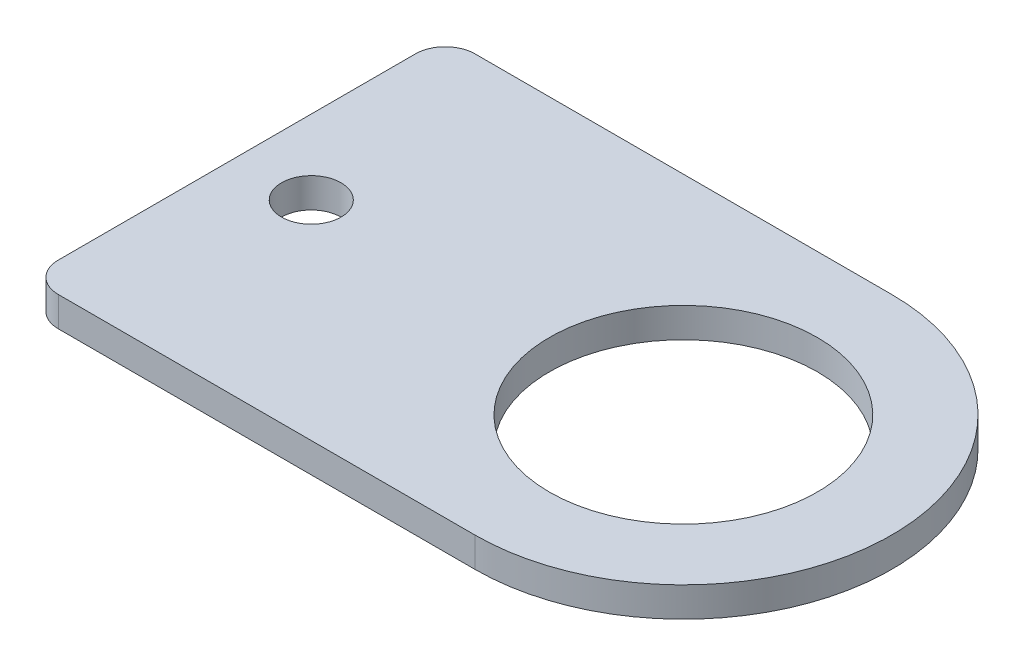
from build123d import *

# Parameters (mm, degrees)
SKETCH1_R           = 2
SKETCH1_R_2         = 9
BOSS_EXTRUDE1_DEPTH = 2
FILLET1_R           = 2


with BuildPart() as part:
    # Sketch1 → Boss-Extrude1 (new body)
    with BuildSketch(Plane(origin=(0, 0, 0), x_dir=(1, 0, 0), z_dir=(0, 1, 0))):
        with BuildLine():
            Line((-15, -14), (15, -14))
            ThreePointArc((15, -14), (29, 0), (15, 14))
            Line((15, 14), (-15, 14))
            Line((-15, 14), (-15, -14))
        make_face()
        with Locations(Location((-10, 0, 0), (0, 0, 270))):
            Circle(SKETCH1_R, mode=Mode.SUBTRACT)
        with Locations(Location((15, 0, 0), (0, 0, 270))):
            Circle(SKETCH1_R_2, mode=Mode.SUBTRACT)
    extrude(amount=BOSS_EXTRUDE1_DEPTH)

    # Fillet1
    fillet1_edges = [part.edges().sort_by_distance(p)[0] for p in [
        (-15, 1, 14),
        (-15, 1, -14),
    ]]
    fillet(fillet1_edges, radius=FILLET1_R)


solid = part.part
